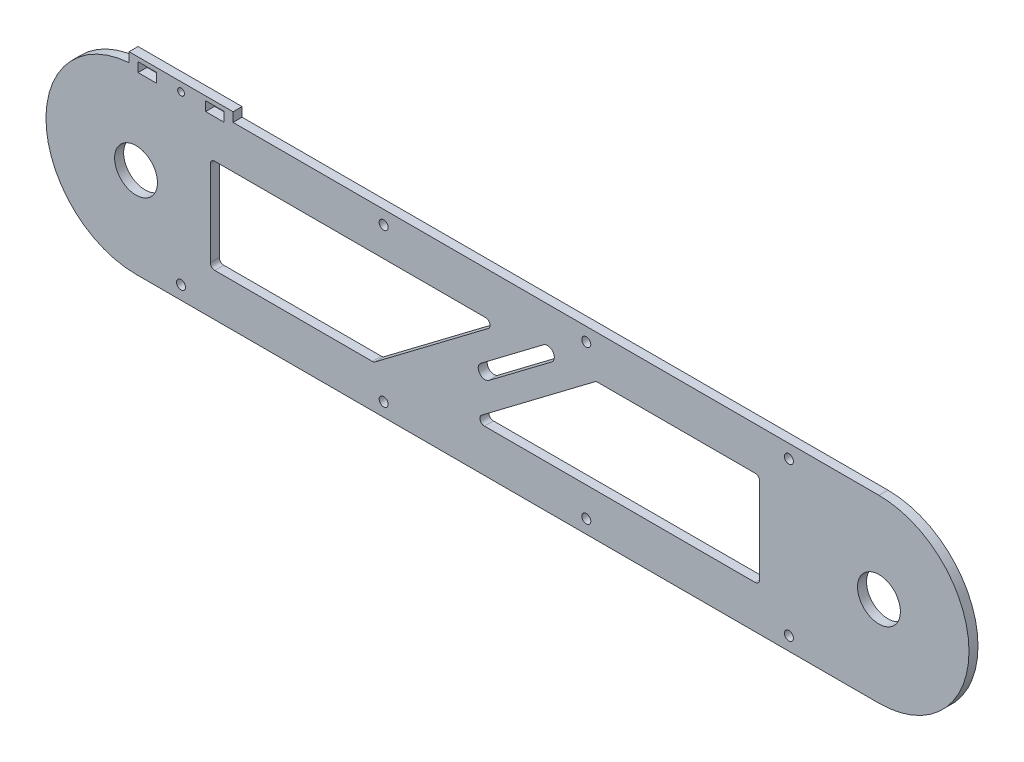
from build123d import *

# Parameters (mm, degrees)
SKETCH_1_R          = 9.52
EXTRUDE_1_DEPTH     = 4
SKETCH_4_W          = 46.2
SKETCH_4_H          = 8.602857229
EXTRUDE_2_DEPTH     = 4
SKETCH_2_R          = 2
SKETCH_2_R_2        = 1.5
SKETCH_2_W          = 8.2
SKETCH_2_H          = 4.2
CUT_EXTRUDE_1_DEPTH = 4
CUT_EXTRUDE_2_DEPTH = 10
FILLET_1_R          = 2


with BuildPart() as part:
    # 草图1 → 凸台-拉伸1 (new body)
    with BuildSketch(Plane.XY):
        with BuildLine():
            Line((328.542857143, -40.145714286), (-1.457142857, -40.145714286))
            ThreePointArc((-1.457142857, -40.145714286), (-41.457142857, -0.145714286), (-1.457142857, 39.854285714))
            Line((-1.457142857, 39.854285714), (328.542857143, 39.854285714))
            ThreePointArc((328.542857143, 39.854285714), (368.542857143, -0.145714286), (328.542857143, -40.145714286))
        make_face()
        with Locations((-1.457142857, -0.145714286)):
            Circle(SKETCH_1_R, mode=Mode.SUBTRACT)
        with Locations((328.542857143, -0.145714286)):
            Circle(SKETCH_1_R, mode=Mode.SUBTRACT)
    extrude(amount=EXTRUDE_1_DEPTH)

    # 草图4 → 凸台-拉伸2 (add)
    with BuildSketch(Plane.XY.offset(4)):
        with Locations((18.542857143, 39.652857099)):
            Rectangle(SKETCH_4_W, SKETCH_4_H)
    extrude(amount=-EXTRUDE_2_DEPTH)

    # 草图2 → 切除-拉伸1 (cut)
    with BuildSketch(Plane.XY.offset(4)):
        with Locations((108.542857143, 33.854285714)):
            Circle(SKETCH_2_R)
        with Locations((198.542857143, 33.854285714)):
            Circle(SKETCH_2_R)
        with Locations((288.542857143, 33.854285714)):
            Circle(SKETCH_2_R)
        with Locations((108.542857143, -34.145714286)):
            Circle(SKETCH_2_R)
        with Locations((198.542857143, -34.145714286)):
            Circle(SKETCH_2_R)
        with Locations((288.542857143, -34.145714286)):
            Circle(SKETCH_2_R)
        with Locations((18.542857143, -34.145714286)):
            Circle(SKETCH_2_R)
        with Locations((18.542857143, 40.014285714)):
            Circle(SKETCH_2_R_2)
        Polygon((31.542857143, -21.145714286), (104.183898028, -21.145714286), (159.772133322, 20.854285714), (31.542857143, 20.854285714), align=None)
        Polygon((275.542857143, 20.854285714), (202.901816258, 20.854285714), (147.313580964, -21.145714286), (275.542857143, -21.145714286), align=None)
        with Locations((33.542857143, 40.014285714)):
            Rectangle(SKETCH_2_W, SKETCH_2_H)
        with Locations((3.542857143, 40.014285714)):
            Rectangle(SKETCH_2_W, SKETCH_2_H)
    extrude(amount=-CUT_EXTRUDE_1_DEPTH, mode=Mode.SUBTRACT)

    # 草图3 → 切除-拉伸2 (cut)
    with BuildSketch(Plane.XY.offset(4)):
        with BuildLine():
            Line((183.145474057, 18.460683743), (155.35135641, -2.539316257))
            ThreePointArc((155.35135641, -2.539316257), (151.149255171, -1.954213553), (151.734357875, 2.247887686))
            Line((151.734357875, 2.247887686), (179.528475522, 23.247887686))
            ThreePointArc((179.528475522, 23.247887686), (183.730576762, 22.662784982), (183.145474057, 18.460683743))
        make_face()
    extrude(amount=-CUT_EXTRUDE_2_DEPTH, mode=Mode.SUBTRACT)

    # 圆角1
    fillet_1_edges = [part.edges().sort_by_distance(p)[0] for p in [
        (31.542857143, -21.145714286, 2),
        (31.542857143, 20.854285714, 2),
        (159.772133322, 20.854285714, 2),
        (104.183898028, -21.145714286, 2),
        (275.542857143, 20.854285714, 2),
        (275.542857143, -21.145714286, 2),
        (147.313580964, -21.145714286, 2),
        (202.901816258, 20.854285714, 2),
    ]]
    fillet(fillet_1_edges, radius=FILLET_1_R)


solid = part.part
